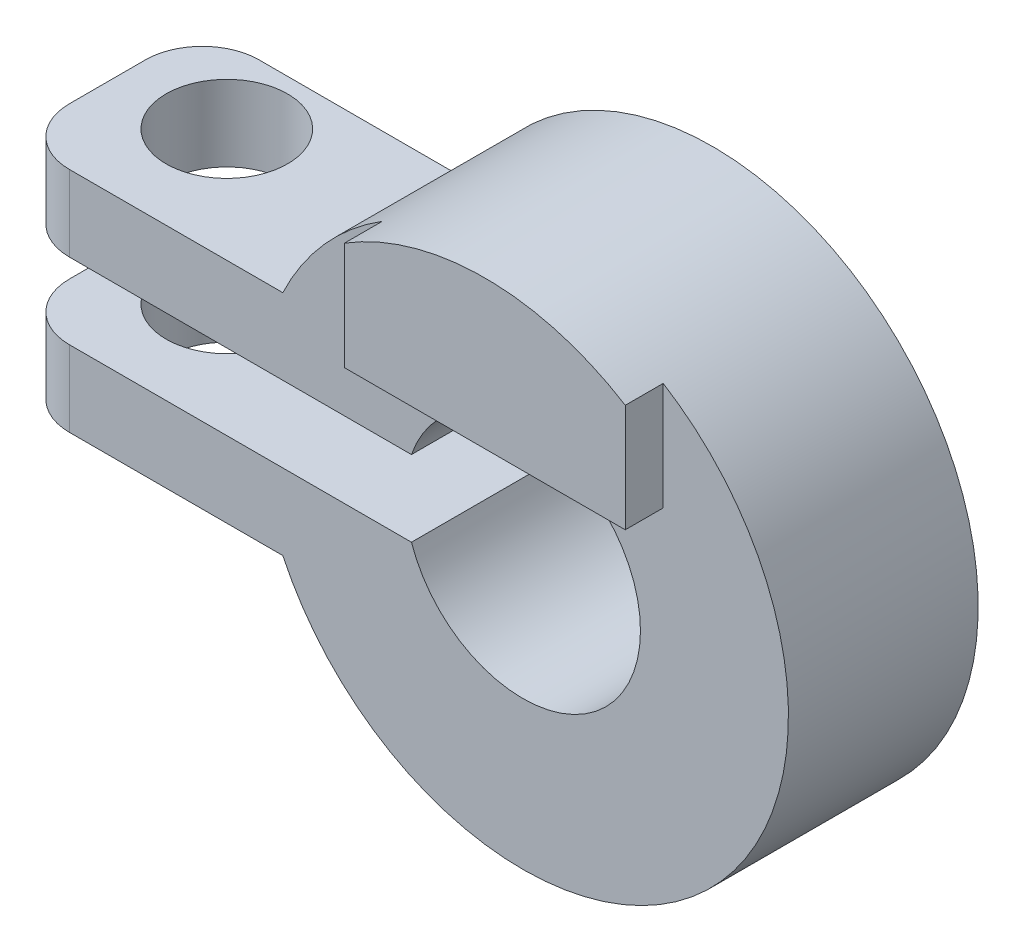
from build123d import *

# Parameters (mm, degrees)
SKETCH_1_R          = 14
SKETCH_1_R_2        = 1.5
EXTRUDE_1_DEPTH     = 2
CUT_EXTRUDE_1_DEPTH = 20.899748742
EXTRUDE_4_DEPTH     = 1
SKETCH_6_R          = 7
SKETCH_6_R_2        = 3.1
EXTRUDE_5_DEPTH     = 5
EXTRUDE_6_DEPTH     = 1
SKETCH_8_W          = 8
SKETCH_8_H          = 2
EXTRUDE_7_DEPTH     = 5
SKETCH_9_R          = 1.6
CUT_EXTRUDE_3_DEPTH = 24.108440017
EXTRUDE_8_DEPTH     = 2
SKETCH_11_W         = 12.041493288
SKETCH_11_H         = 2
CUT_EXTRUDE_4_DEPTH = 5
SKETCH_12_R         = 20
SKETCH_12_R_2       = 3.1
EXTRUDE_9_DEPTH     = 2
SKETCH_13_R         = 2.3
CUT_EXTRUDE_5_DEPTH = 2
CUT_EXTRUDE_START   = -1
CUT_EXTRUDE_6_DEPTH = 1
FILLET_1_R          = 3
FILLET_2_R          = 1.5
SKETCH_15_R         = 20
CUT_EXTRUDE_7_DEPTH = 2
SKETCH_16_R         = 7
CUT_EXTRUDE_8_DEPTH = 5


with BuildPart() as part:
    # 草图1 → 凸台-拉伸1 (new body)
    with BuildSketch(Plane.XY):
        Circle(SKETCH_1_R)
        with Locations((-7.071067812, 7.071067812)):
            Circle(SKETCH_1_R_2, mode=Mode.SUBTRACT)
        with Locations((7.071067812, 7.071067812)):
            Circle(SKETCH_1_R_2, mode=Mode.SUBTRACT)
        with Locations((-7.071067812, -7.071067812)):
            Circle(SKETCH_1_R_2, mode=Mode.SUBTRACT)
        with Locations((7.071067812, -7.071067812)):
            Circle(SKETCH_1_R_2, mode=Mode.SUBTRACT)
    extrude(amount=EXTRUDE_1_DEPTH)

    # 草图2 → 切除-拉伸1 (cut, through all)
    with BuildSketch(Plane(origin=(0, 0, 0), x_dir=(-1, 0, 0), z_dir=(0, 0, -1))):
        with BuildLine():
            ThreePointArc((-2.683281573, 3.1), (-4.1, 0), (-2.683281573, -3.1))
            Line((-2.683281573, -3.1), (2.683281573, -3.1))
            ThreePointArc((2.683281573, -3.1), (4.1, 0), (2.683281573, 3.1))
            Line((2.683281573, 3.1), (-2.683281573, 3.1))
        make_face()
    extrude(amount=-CUT_EXTRUDE_1_DEPTH, mode=Mode.SUBTRACT)

    # 草图3 → 凸台-拉伸4 (add)
    with BuildSketch(Plane(origin=(0, 0, 0), x_dir=(-1, 0, 0), z_dir=(0, 0, -1))):
        Polygon((0, 3.1), (3.7, 3.1), (3.7, 7.1), (-3.7, 7.1), (-3.7, 3.1), align=None)
    extrude(amount=EXTRUDE_4_DEPTH)

    # 草图6 → 凸台-拉伸5 (add)
    with BuildSketch(Plane(origin=(0, 0, -1), x_dir=(-1, 0, 0), z_dir=(0, 0, -1))):
        with Locations(Location((0, 0, 0), (0, 0, 121.908982735))):
            Circle(SKETCH_6_R)
        with Locations(Location((0, 0, 0), (0, 0, 90))):
            Circle(SKETCH_6_R_2, mode=Mode.SUBTRACT)
    extrude(amount=EXTRUDE_5_DEPTH)

    # 草图7 → 凸台-拉伸6 (add)
    with BuildSketch(Plane(origin=(0, 0, -6), x_dir=(-1, 0, 0), z_dir=(0, 0, -1))):
        with BuildLine():
            Line((-2.5, 3.1), (-2.5, 6.538348415))
            ThreePointArc((-2.5, 6.538348415), (0, 7), (2.5, 6.538348415))
            Line((2.5, 6.538348415), (2.5, 3.1))
            Line((2.5, 3.1), (-2.5, 3.1))
        make_face()
    extrude(amount=EXTRUDE_6_DEPTH)

    # 草图8 → 凸台-拉伸7 (add)
    with BuildSketch(Plane(origin=(0, 0, -6), x_dir=(-1, 0, 0), z_dir=(0, 0, -1))):
        with Locations((9.447401339, 2)):
            Rectangle(SKETCH_8_W, SKETCH_8_H)
        with Locations((9.447401339, -2)):
            Rectangle(SKETCH_8_W, SKETCH_8_H)
    extrude(amount=-EXTRUDE_7_DEPTH)

    # 草图9 → 切除-拉伸3 (cut, through all)
    with BuildSketch(Plane(origin=(0, 3, 0), x_dir=(1, 0, 0), z_dir=(0, 1, 0))):
        with Locations(Location((-10.8, 4, 0), (0, 0, 180))):
            Circle(SKETCH_9_R)
    extrude(amount=-CUT_EXTRUDE_3_DEPTH, mode=Mode.SUBTRACT)

    # 草图10 → 凸台-拉伸8 (add)
    with BuildSketch(Plane(origin=(0, 0, -7), x_dir=(-1, 0, 0), z_dir=(0, 0, -1))):
        with BuildLine():
            Line((-2.5, 6.538348415), (-2.5, 3.1))
            ThreePointArc((-2.5, 3.1), (0, -3.98246155), (2.5, 3.1))
            Line((2.5, 3.1), (2.5, 6.538348415))
            ThreePointArc((2.5, 6.538348415), (0, 7), (-2.5, 6.538348415))
        make_face()
    extrude(amount=EXTRUDE_8_DEPTH)

    # 草图11 → 切除-拉伸4 (cut)
    with BuildSketch(Plane(origin=(0, 0, -6), x_dir=(-1, 0, 0), z_dir=(0, 0, -1))):
        with Locations((7.426654695, 0)):
            Rectangle(SKETCH_11_W, SKETCH_11_H)
    extrude(amount=-CUT_EXTRUDE_4_DEPTH, mode=Mode.SUBTRACT)

    # 草图12 → 凸台-拉伸9 (add)
    with BuildSketch(Plane.XY.offset(2)):
        Circle(SKETCH_12_R)
        Circle(SKETCH_12_R_2, mode=Mode.SUBTRACT)
    extrude(amount=-EXTRUDE_9_DEPTH)

    # 草图13 → 切除-拉伸5 (cut)
    with BuildSketch(Plane.XY.offset(2)):
        with Locations((10.253048327, 10.253048327)):
            Circle(SKETCH_13_R)
        with Locations((-10.253048327, 10.253048327)):
            Circle(SKETCH_13_R)
        with Locations((-10.253048327, -10.253048327)):
            Circle(SKETCH_13_R)
        with Locations((10.253048327, -10.253048327)):
            Circle(SKETCH_13_R)
    extrude(amount=-CUT_EXTRUDE_5_DEPTH, mode=Mode.SUBTRACT)

    # 草图14 → 切除-拉伸6 (cut)
    with BuildSketch(Plane(origin=(0, 0, -1), x_dir=(-1, 0, 0), z_dir=(0, 0, -1)).offset(CUT_EXTRUDE_START)):
        with BuildLine():
            Line((-4.590882623, 5.284297185), (-4.590882623, 9.738638689))
            Line((-4.590882623, 9.738638689), (4.724825977, 9.738638689))
            Line((4.724825977, 9.738638689), (4.724825977, 5.164883298))
            ThreePointArc((4.724825977, 5.164883298), (0.089722487, 6.999424967), (-4.590882623, 5.284297185))
        make_face()
    extrude(amount=CUT_EXTRUDE_6_DEPTH, mode=Mode.SUBTRACT)

    # 圆角1
    fillet_1_edges = [part.edges().sort_by_distance(p)[0] for p in [
        (0, 7, -9),
    ]]
    fillet(fillet_1_edges, radius=FILLET_1_R)

    # 圆角2
    fillet_2_edges = [part.edges().sort_by_distance(p)[0] for p in [
        (-13.447401339, -2, -1),
        (-13.447401339, -2, -6),
        (-13.447401339, 2, -1),
        (-13.447401339, 2, -6),
    ]]
    fillet(fillet_2_edges, radius=FILLET_2_R)

    # 草图15 → 切除-拉伸7 (cut)
    with BuildSketch(Plane.XY.offset(2)):
        Circle(SKETCH_15_R)
    extrude(amount=-CUT_EXTRUDE_7_DEPTH, mode=Mode.SUBTRACT)

    # 草图16 → 切除-拉伸8 (cut)
    with BuildSketch(Plane(origin=(0, 0, -6), x_dir=(-1, 0, 0), z_dir=(0, 0, -1))):
        Circle(SKETCH_16_R)
    extrude(amount=CUT_EXTRUDE_8_DEPTH, mode=Mode.SUBTRACT)


solid = part.part
